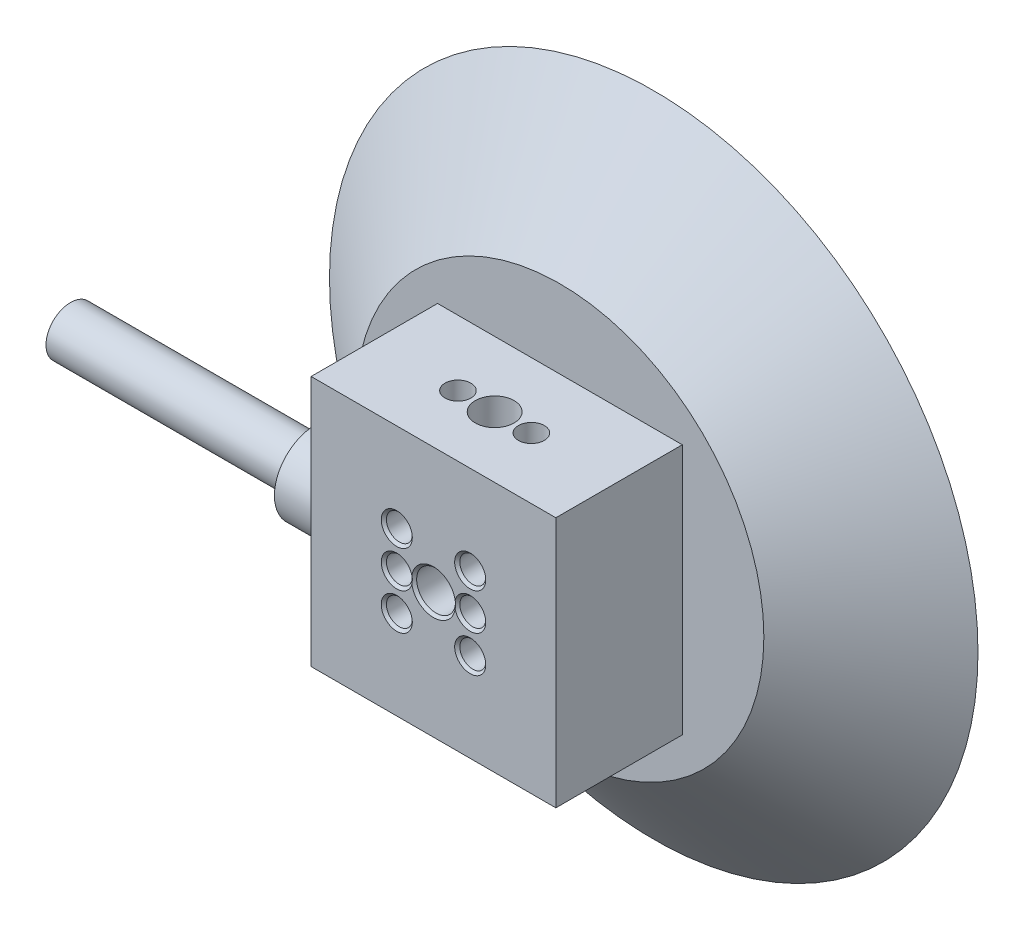
from build123d import *

# Parameters (mm, degrees)
SKETCH_2_R                          = 79.5
SKETCH_3_R                          = 50
SKETCH_4_W                          = 60
SKETCH_4_H                          = 61.6
EXTRUDE_1_DEPTH                     = 31
EXTRUDE_2_DEPTH                     = 10
SKETCH_6_R                          = 6
EXTRUDE_3_DEPTH                     = 60
HOLE_WIZARD_3_8_0_375_1_D           = 9.525
HOLE_WIZARD_3_8_0_375_1_CSINK_D     = 10.795
HOLE_WIZARD_3_8_0_375_1_CSINK_ANGLE = 90
HOLE_WIZARD_1_4_0_25_1_D            = 6.35
HOLE_WIZARD_1_4_0_25_1_CSINK_D      = 7.62
HOLE_WIZARD_1_4_0_25_1_CSINK_ANGLE  = 90
HOLE_WIZARD_3_8_0_375_2_D           = 9.525
HOLE_WIZARD_3_8_0_375_2_CSINK_D     = 10.795
HOLE_WIZARD_3_8_0_375_2_CSINK_ANGLE = 90
HOLE_WIZARD_1_4_0_25_2_D            = 6.35
HOLE_WIZARD_1_4_0_25_2_CSINK_D      = 7.62
HOLE_WIZARD_1_4_0_25_2_CSINK_ANGLE  = 90


with BuildPart() as part:
    # 草图2 → 放样1 section 0
    with BuildSketch(Plane.XY):
        Circle(SKETCH_2_R)
    # 草图3 → 放样1 section 1
    with BuildSketch(Plane.XY.offset(23)):
        Circle(SKETCH_3_R)
    loft()

    # 草图4 → 凸台-拉伸1 (add)
    with BuildSketch(Plane.XY.offset(23)):
        Rectangle(SKETCH_4_W, SKETCH_4_H)
    extrude(amount=EXTRUDE_1_DEPTH)

    # 草图5 → 凸台-拉伸2 (add)
    with BuildSketch(Plane.ZY.offset(30)):
        with BuildLine():
            Line((23, 10), (43, 10))
            ThreePointArc((43, 10), (53, 0), (43, -10))
            Line((43, -10), (23, -10))
            Line((23, -10), (23, 10))
        make_face()
    extrude(amount=EXTRUDE_2_DEPTH)

    # 草图6 → 凸台-拉伸3 (add)
    with BuildSketch(Plane.ZY.offset(40)):
        with Locations((43, 0)):
            Circle(SKETCH_6_R)
    extrude(amount=EXTRUDE_3_DEPTH)

    # 3/8 (0.375) 直径孔1 (through all)
    with Locations(Plane.XY.offset(54)):
        with Locations((0, 0)):
            CounterSinkHole(HOLE_WIZARD_3_8_0_375_1_D / 2, HOLE_WIZARD_3_8_0_375_1_CSINK_D / 2, counter_sink_angle=HOLE_WIZARD_3_8_0_375_1_CSINK_ANGLE)

    # 1/4 (0.25) 直径孔1 (through all)
    with Locations(Plane.XY.offset(54)):
        with Locations((9, 9), (-9, 9), (-9, 0), (-9, -9), (9, -9), (9, 0)):
            CounterSinkHole(HOLE_WIZARD_1_4_0_25_1_D / 2, HOLE_WIZARD_1_4_0_25_1_CSINK_D / 2, counter_sink_angle=HOLE_WIZARD_1_4_0_25_1_CSINK_ANGLE)

    # 3/8 (0.375) 直径孔2 (through all)
    with Locations(Plane.XZ.offset(30.8)):
        with Locations((0, 39)):
            CounterSinkHole(HOLE_WIZARD_3_8_0_375_2_D / 2, HOLE_WIZARD_3_8_0_375_2_CSINK_D / 2, counter_sink_angle=HOLE_WIZARD_3_8_0_375_2_CSINK_ANGLE)

    # 1/4 (0.25) 直径孔2 (through all)
    with Locations(Plane(origin=(0, -30.8, 0), x_dir=(-1, 0, 0), z_dir=(0, -1, 0))):
        with Locations((9, -39), (-9, -39)):
            CounterSinkHole(HOLE_WIZARD_1_4_0_25_2_D / 2, HOLE_WIZARD_1_4_0_25_2_CSINK_D / 2, counter_sink_angle=HOLE_WIZARD_1_4_0_25_2_CSINK_ANGLE)


solid = part.part
